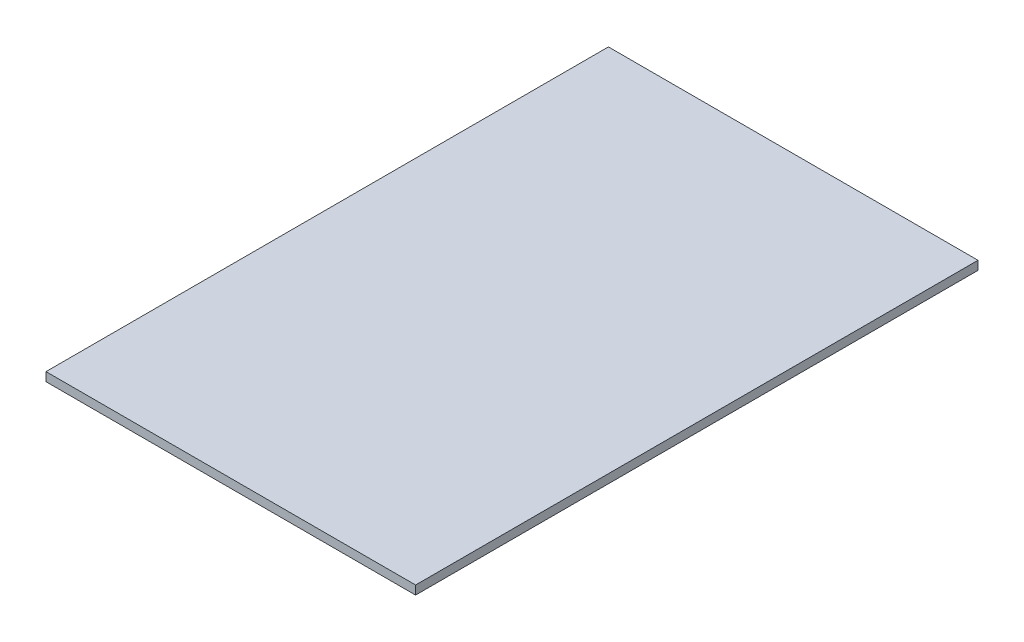
from build123d import *

# Parameters (mm, degrees)
SKETCH1_W           = 126.5
SKETCH1_H           = 192.5
BOSS_EXTRUDE1_DEPTH = 3


with BuildPart() as part:
    # Sketch1 → Boss-Extrude1 (new body)
    with BuildSketch(Plane(origin=(0, 0, 0), x_dir=(1, 0, 0), z_dir=(0, 1, 0))):
        Rectangle(SKETCH1_W, SKETCH1_H)
    extrude(amount=BOSS_EXTRUDE1_DEPTH)


solid = part.part
